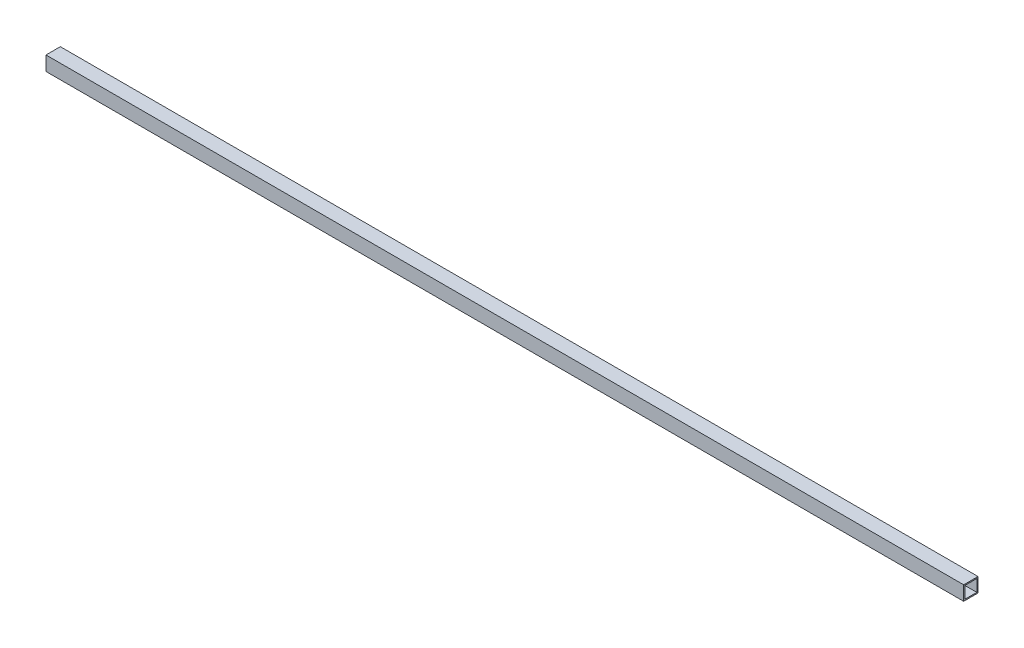
from build123d import *

# Parameters (mm, degrees)
SKETCH1_W           = 19.05
SKETCH1_H           = 19.05
SKETCH1_W_2         = 15.875
SKETCH1_H_2         = 15.875
BOSS_EXTRUDE1_DEPTH = 1219.2


with BuildPart() as part:
    # Sketch1 → Boss-Extrude1 (new body)
    with BuildSketch(Plane(origin=(0, 0, 0), x_dir=(0, 0, -1), z_dir=(1, 0, 0))):
        Rectangle(SKETCH1_W, SKETCH1_H)
        Rectangle(SKETCH1_W_2, SKETCH1_H_2, mode=Mode.SUBTRACT)
    extrude(amount=BOSS_EXTRUDE1_DEPTH)


solid = part.part
